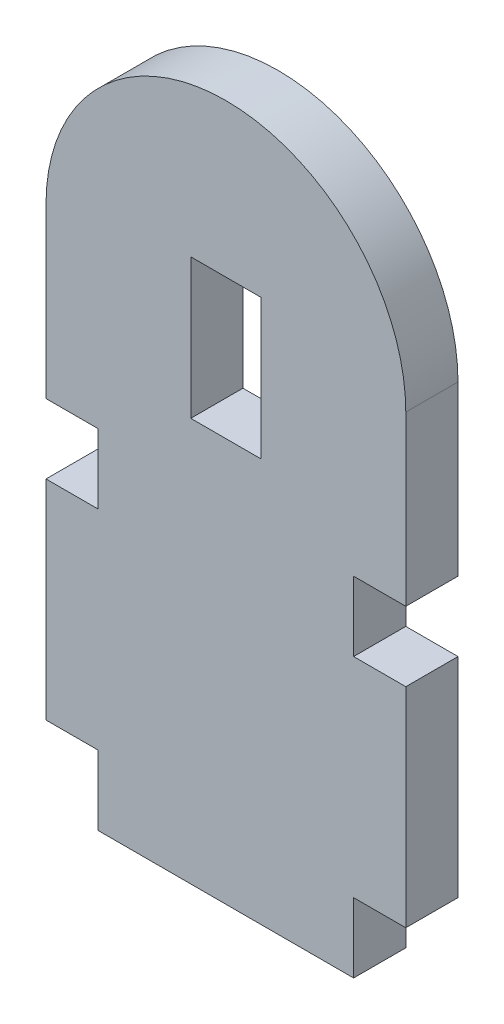
from build123d import *

# Parameters (mm, degrees)
ESQUISSE1_W        = 20.2
ESQUISSE1_H        = 40.2
BOSS_EXTRU_1_DEPTH = 15


with BuildPart() as part:
    # Esquisse1 → Boss.-Extru.1 (new body)
    with BuildSketch(Plane.XY):
        with BuildLine():
            Line((-35.249311761, -55), (-35.249311761, -75))
            Line((-35.249311761, -75), (38.140688239, -75))
            Line((38.140688239, -75), (38.140688239, -55))
            Line((38.140688239, -55), (53.140688239, -55))
            Line((53.140688239, -55), (53.140688239, 5))
            Line((53.140688239, 5), (38.140688239, 5))
            Line((38.140688239, 5), (38.140688239, 25))
            Line((38.140688239, 25), (53.140688239, 25))
            Line((53.140688239, 25), (53.140688239, 73.326682602))
            ThreePointArc((53.140688239, 73.326682602), (1.445688239, 125.021682602), (-50.249311761, 73.326682602))
            Line((-50.249311761, 73.326682602), (-50.249311761, 25))
            Line((-50.249311761, 25), (-35.249311761, 25))
            Line((-35.249311761, 25), (-35.249311761, 5))
            Line((-35.249311761, 5), (-50.249311761, 5))
            Line((-50.249311761, 5), (-50.249311761, -55))
            Line((-50.249311761, -55), (-35.249311761, -55))
        make_face()
        with Locations((1.445688239, 60.982767533)):
            Rectangle(ESQUISSE1_W, ESQUISSE1_H, mode=Mode.SUBTRACT)
    extrude(amount=BOSS_EXTRU_1_DEPTH)


solid = part.part
